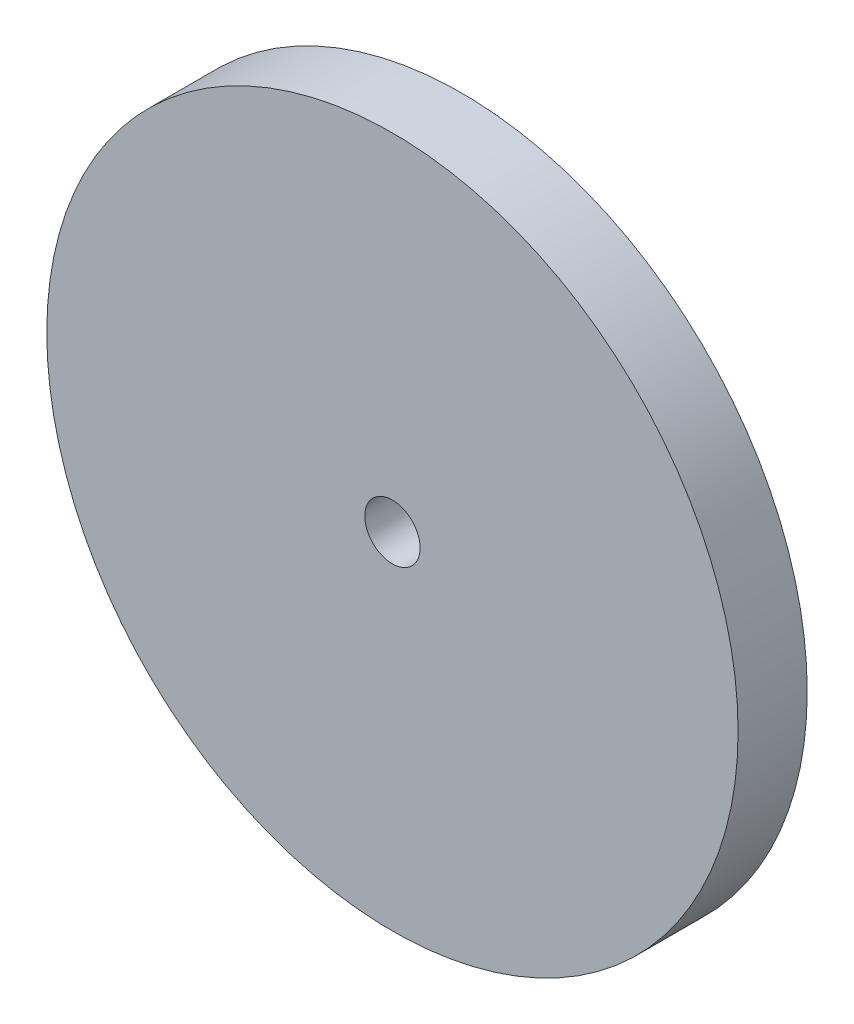
from build123d import *

# Parameters (mm, degrees)
SKETCH1_R           = 50
SKETCH1_R_2         = 4
BOSS_EXTRUDE1_DEPTH = 10


with BuildPart() as part:
    # Sketch1 → Boss-Extrude1 (new body)
    with BuildSketch(Plane.XY):
        Circle(SKETCH1_R)
        Circle(SKETCH1_R_2, mode=Mode.SUBTRACT)
    extrude(amount=BOSS_EXTRUDE1_DEPTH)


solid = part.part
